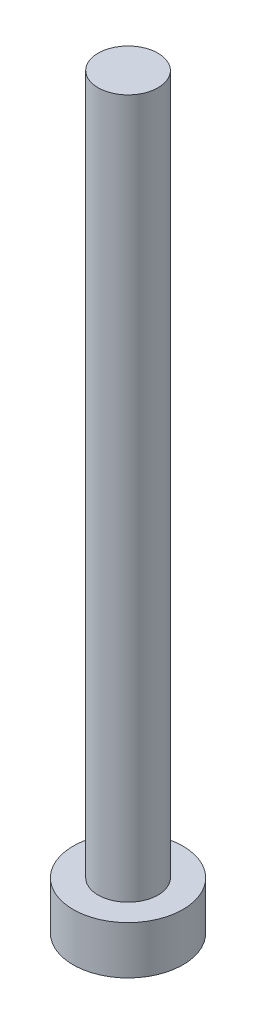
from build123d import *


with BuildPart() as part:
    # Sketch1 → Revolve1 (revolve)
    with BuildSketch(Plane(origin=(0, 0, 0), x_dir=(0, 0, -1), z_dir=(1, 0, 0))):
        Polygon((0, 0), (0, 35), (1.5, 35), (1.5, 0), (2.75, 0), (2.75, -2.4), (0, -2.4), align=None)
    revolve(axis=Axis((0, 0, 0), (0, 1, 0)))


solid = part.part
